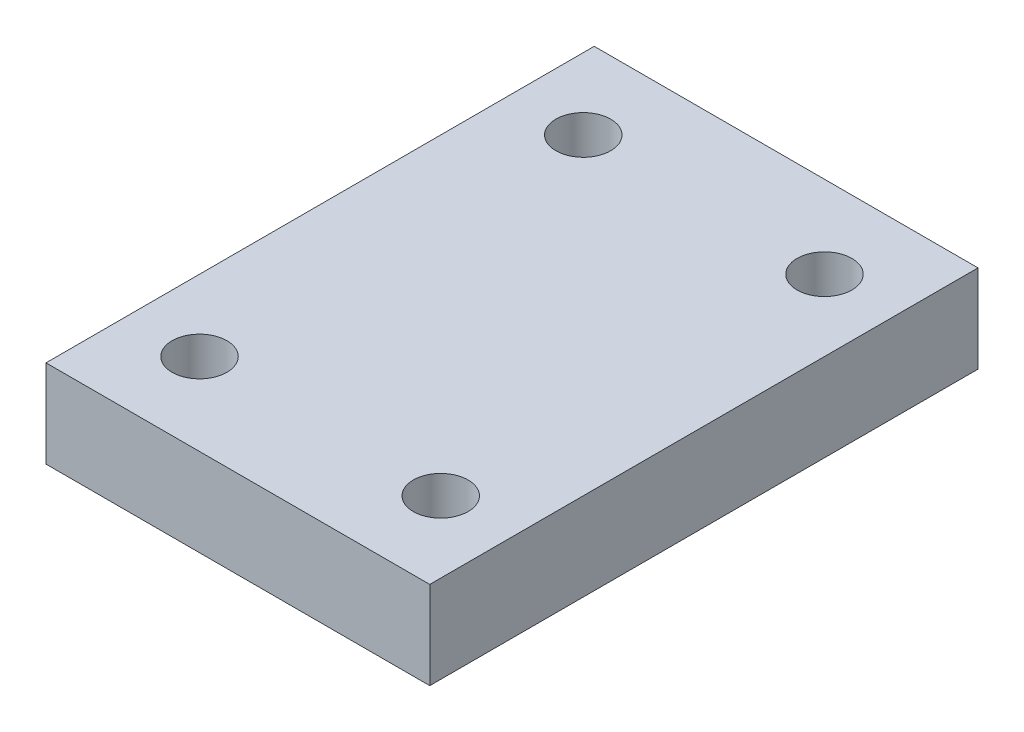
from build123d import *

# Parameters (mm, degrees)
SKETCH1_W           = 35
SKETCH1_H           = 50
SKETCH1_R           = 2.5
BOSS_EXTRUDE1_DEPTH = 8


with BuildPart() as part:
    # Sketch1 → Boss-Extrude1 (new body)
    with BuildSketch(Plane(origin=(0, 0, 0), x_dir=(1, 0, 0), z_dir=(0, 1, 0))):
        Rectangle(SKETCH1_W, SKETCH1_H)
        with Locations(Location((11, 17.5, 0), (0, 0, 270))):
            Circle(SKETCH1_R, mode=Mode.SUBTRACT)
        with Locations(Location((11, -17.5, 0), (0, 0, 270))):
            Circle(SKETCH1_R, mode=Mode.SUBTRACT)
        with Locations(Location((-11, 17.5, 0), (0, 0, 270))):
            Circle(SKETCH1_R, mode=Mode.SUBTRACT)
        with Locations(Location((-11, -17.5, 0), (0, 0, 270))):
            Circle(SKETCH1_R, mode=Mode.SUBTRACT)
    extrude(amount=BOSS_EXTRUDE1_DEPTH)


solid = part.part
